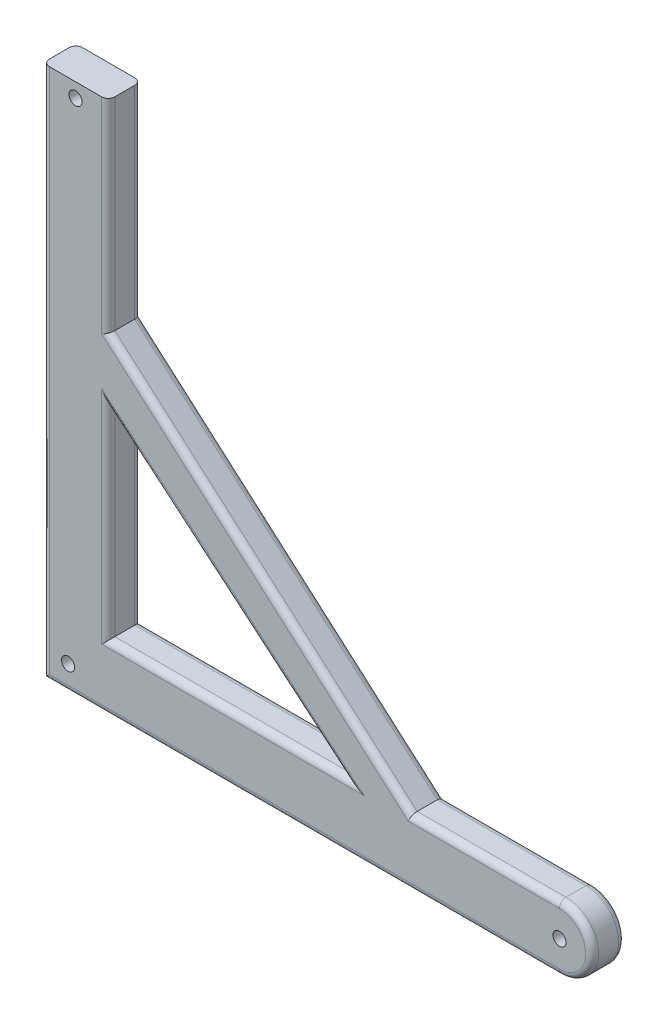
from build123d import *

# Parameters (mm, degrees)
SALIENTE_EXTRUIR1_DEPTH = 10.1
CORTAR_EXTRUIR1_DEPTH   = 10.1
REDONDEO1_R             = 2
CROQUIS3_R              = 2
CORTAR_EXTRUIR2_DEPTH   = 10.1


with BuildPart() as part:
    # Croquis1 → Saliente-Extruir1 (new body)
    with BuildSketch(Plane.XY):
        with BuildLine():
            Line((84.879626458, -20), (-27.620373542, -20))
            Line((-27.620373542, -20), (-27.620373542, 81.07249842))
            Line((-27.620373542, 81.07249842), (-27.620373542, 143))
            Line((-27.620373542, 143), (-7.620373542, 143))
            Line((-7.620373542, 143), (-7.620373542, 81.07249842))
            Line((-7.620373542, 81.07249842), (84.879626458, 0))
            Line((84.879626458, 0), (130.379626458, 0))
            ThreePointArc((130.379626458, 0), (140.379626458, -10), (130.379626458, -20))
            Line((130.379626458, -20), (84.879626458, -20))
        make_face()
    extrude(amount=SALIENTE_EXTRUIR1_DEPTH)

    # Croquis2 → Cortar-Extruir1 (cut)
    with BuildSketch(Plane.XY.offset(10.1)):
        Polygon((-7.620373542, 61.46249842), (-7.620373542, 0), (65.269626458, 0), align=None)
    extrude(amount=-CORTAR_EXTRUIR1_DEPTH, mode=Mode.SUBTRACT)

    # Redondeo1
    redondeo1_edges = [part.edges().sort_by_distance(p)[0] for p in [
        (140.379626458, -10, 0),
        (140.379626458, -10, 10.1),
        (-27.620373542, 61.5, 10.1),
        (-27.620373542, 61.5, 0),
        (51.379626458, -20, 0),
        (51.379626458, -20, 10.1),
        (28.824626458, 30.73124921, 10.1),
        (28.824626458, 0, 10.1),
        (-7.620373542, 30.73124921, 10.1),
        (-7.620373542, 30.73124921, 0),
        (28.824626458, 30.73124921, 0),
        (28.824626458, 0, 0),
        (107.629626458, 0, 0),
        (107.629626458, 0, 10.1),
        (38.629626458, 40.53624921, 0),
        (38.629626458, 40.53624921, 10.1),
        (-7.620373542, 112.03624921, 0),
        (-7.620373542, 112.03624921, 10.1),
    ]]
    fillet(redondeo1_edges, radius=REDONDEO1_R)

    # Croquis3 → Cortar-Extruir2 (cut)
    with BuildSketch(Plane.XY.offset(10.1)):
        with Locations((130.379626458, -10)):
            Circle(CROQUIS3_R)
        with Locations((-19.903008845, -12.282635303)):
            Circle(CROQUIS3_R)
        with Locations((-17.620373542, 138.637591641)):
            Circle(CROQUIS3_R)
    extrude(amount=-CORTAR_EXTRUIR2_DEPTH, mode=Mode.SUBTRACT)


solid = part.part
